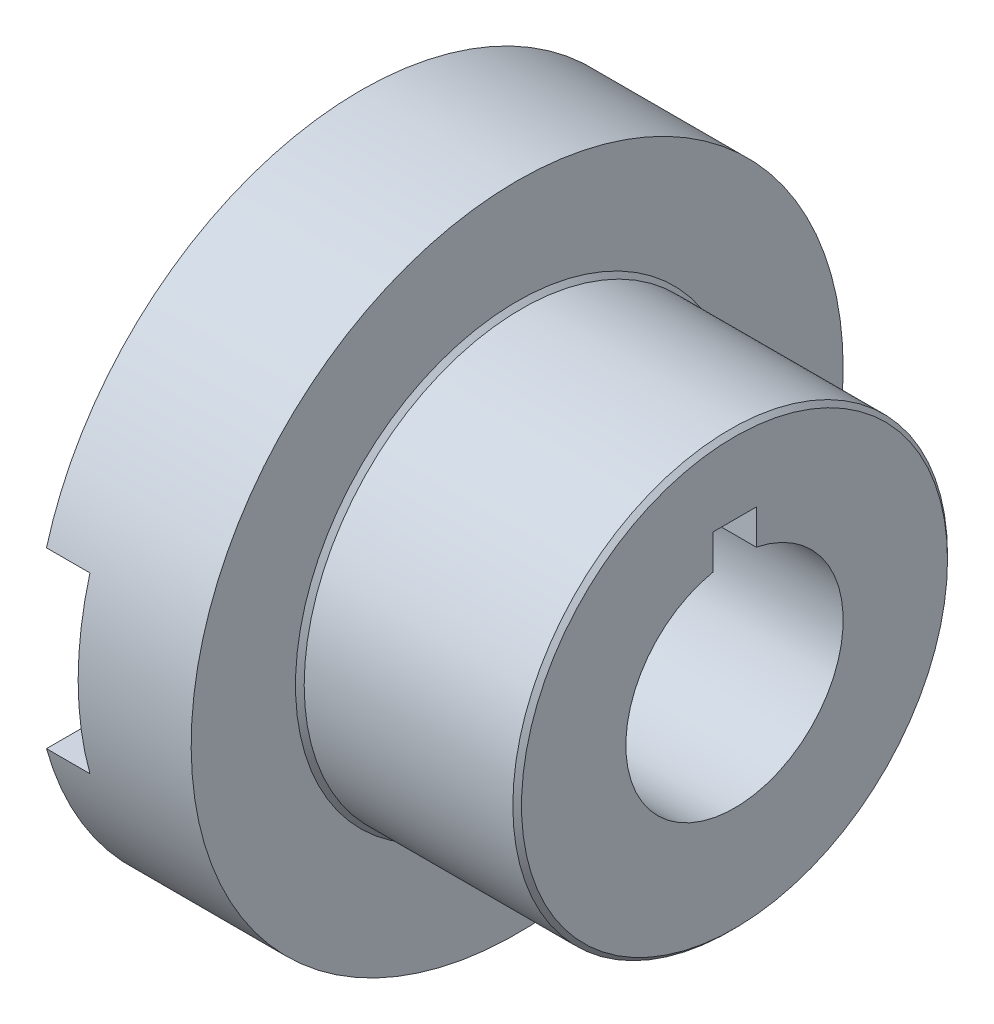
from build123d import *

# Parameters (mm, degrees)
SKETCH1_R           = 75
BOSS_EXTRUDE1_DEPTH = 36
SKETCH2_R           = 50
BOSS_EXTRUDE2_DEPTH = 50
CUT_EXTRUDE2_DEPTH  = 10
CUT_EXTRUDE3_DEPTH  = 76
CHAMFER1_SIZE       = 1
CHAMFER2_SIZE       = 1


with BuildPart() as part:
    # Sketch1 → Boss-Extrude1 (new body)
    with BuildSketch(Plane(origin=(0, 0, 0), x_dir=(0, 0, -1), z_dir=(1, 0, 0))):
        Circle(SKETCH1_R)
    extrude(amount=BOSS_EXTRUDE1_DEPTH)

    # Sketch2 → Boss-Extrude2 (add)
    with BuildSketch(Plane(origin=(36, 0, 0), x_dir=(0, 0, -1), z_dir=(1, 0, 0))):
        Circle(SKETCH2_R)
    extrude(amount=BOSS_EXTRUDE2_DEPTH)

    # Sketch4 → Cut-Extrude2 (cut)
    with BuildSketch(Plane.ZY):
        with BuildLine():
            Line((-72.284161474, 20), (72.284161474, 20))
            ThreePointArc((72.284161474, 20), (75, 0), (72.284161474, -20))
            Line((72.284161474, -20), (-72.284161474, -20))
            ThreePointArc((-72.284161474, -20), (-75, 0), (-72.284161474, 20))
        make_face()
    extrude(amount=-CUT_EXTRUDE2_DEPTH, mode=Mode.SUBTRACT)

    # Sketch5 → Cut-Extrude3 (cut)
    with BuildSketch(Plane(origin=(86, 0, 0), x_dir=(0, 0, -1), z_dir=(1, 0, 0))):
        with BuildLine():
            Line((-5, 32.494897428), (5, 32.494897428))
            Line((5, 32.494897428), (5, 24.494897428))
            ThreePointArc((5, 24.494897428), (0, -25), (-5, 24.494897428))
            Line((-5, 24.494897428), (-5, 32.494897428))
        make_face()
    extrude(amount=-CUT_EXTRUDE3_DEPTH, mode=Mode.SUBTRACT)

    # Chamfer1
    chamfer1_edges = [part.edges().sort_by_distance(p)[0] for p in [
        (86, 0, 50),
    ]]
    chamfer(chamfer1_edges, length=CHAMFER1_SIZE)

    # Chamfer2
    chamfer2_edges = [part.edges().sort_by_distance(p)[0] for p in [
        (36, 0, 50),
    ]]
    chamfer(chamfer2_edges, length=CHAMFER2_SIZE)


solid = part.part
